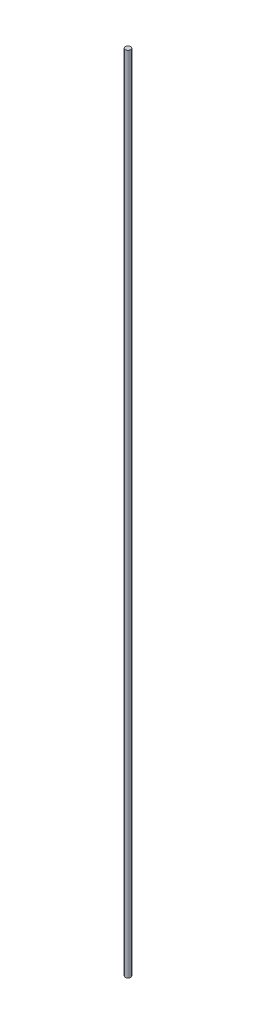
from build123d import *

# Parameters (mm, degrees)
ESBO_O2_R                = 1
RESSALTO_EXTRUS_O1_DEPTH = 300


with BuildPart() as part:
    # Esboço2 → Ressalto-extrusão1 (new body)
    with BuildSketch(Plane(origin=(0, 0, 0), x_dir=(1, 0, 0), z_dir=(0, 1, 0))):
        with Locations(Location((0, 0, 0), (0, 0, 270))):
            Circle(ESBO_O2_R)
    extrude(amount=RESSALTO_EXTRUS_O1_DEPTH)


solid = part.part
